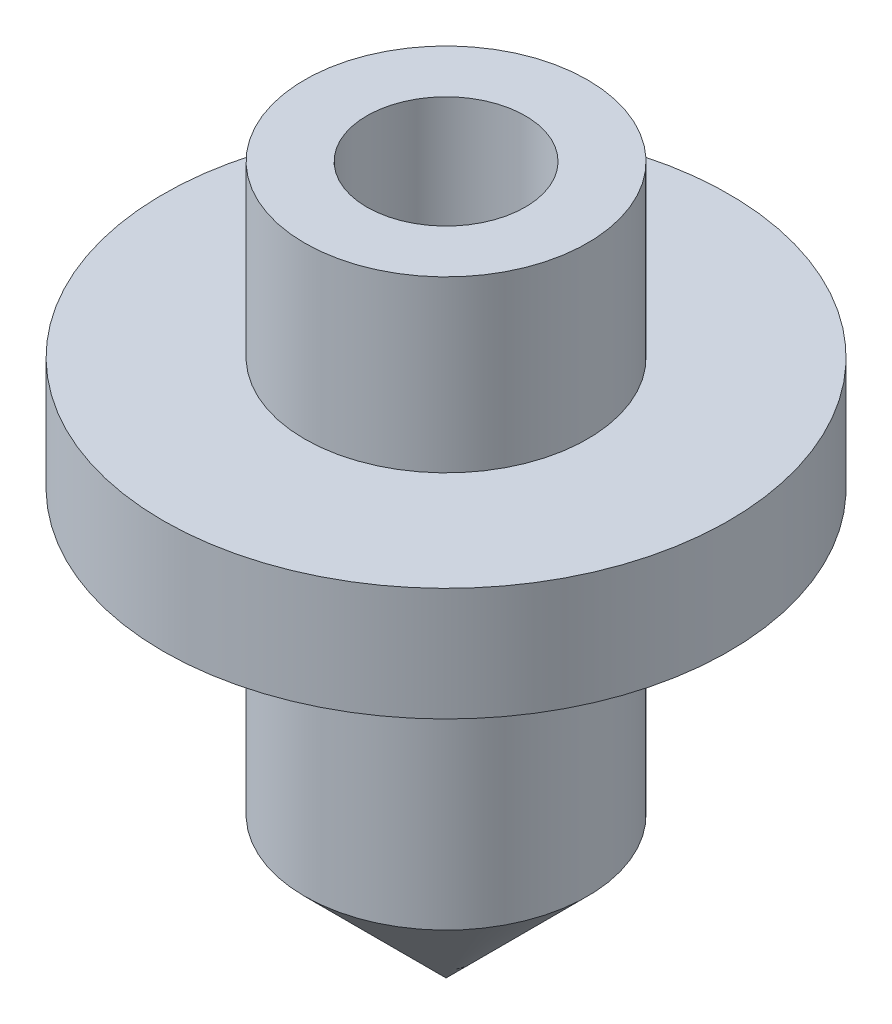
from build123d import *


with BuildPart() as part:
    # Sketch1 → Revolve1 (revolve)
    with BuildSketch(Plane(origin=(0, 0, 0), x_dir=(0, 0, -1), z_dir=(1, 0, 0))):
        Polygon((-25, 21.471853961), (-25, -28.528146039), (0, -53.528146039), (0, -28.528146039), (-14, -28.528146039), (-14, 71.471853961), (-25, 71.471853961), (-25, 41.471853961), (-50, 41.471853961), (-50, 21.471853961), align=None)
    revolve(axis=Axis((0, 58.138989395, 0), (0, -1, 0)))


solid = part.part
